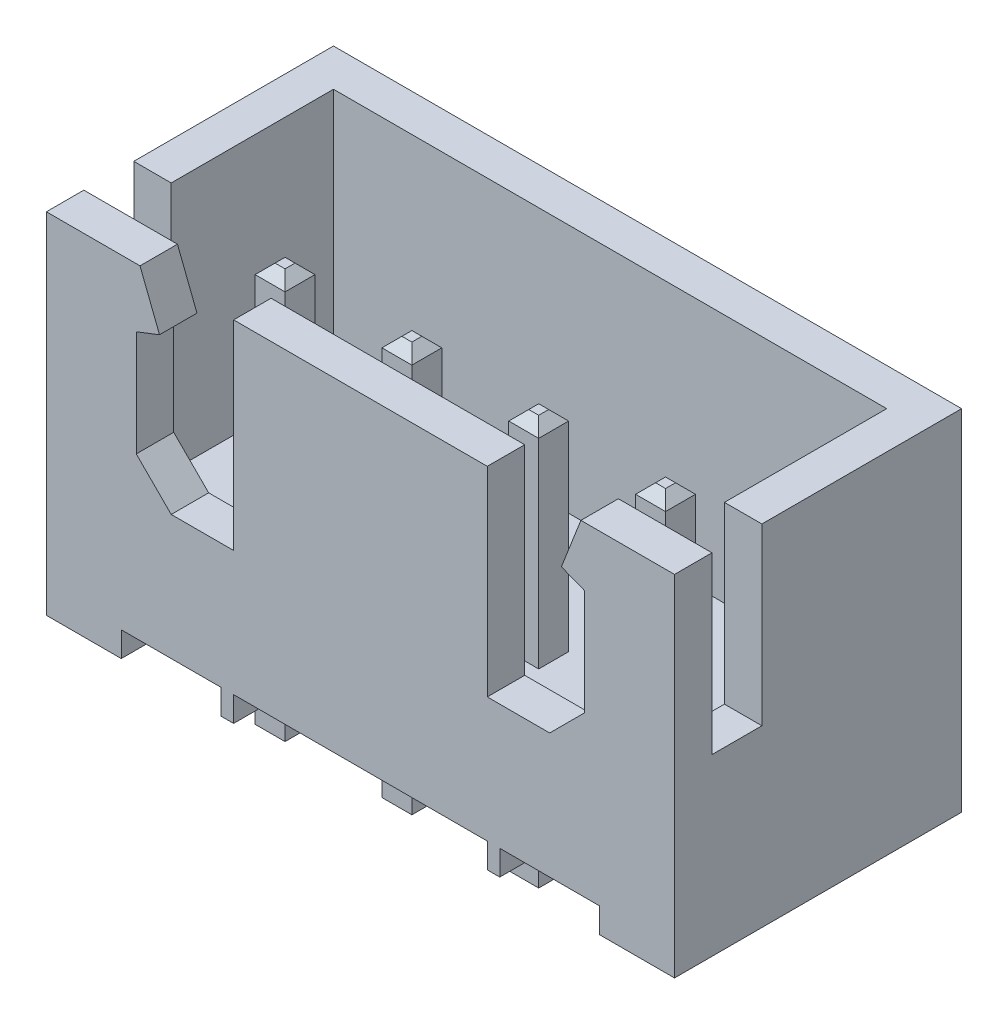
from build123d import *

# Parameters (mm, degrees)
SKETCH1_W           = 3.75
SKETCH1_H           = 5.75
BOSS_EXTRUDE1_DEPTH = 7
CUT_EXTRUDE1_DEPTH  = 5
SKETCH4_W           = 2
SKETCH4_H           = 0.5
CUT_EXTRUDE2_DEPTH  = 10.804335776
CUT_EXTRUDE3_REACH  = 11.804
BOSS_EXTRUDE2_START = -4
SKETCH6_W           = 0.6
SKETCH6_H           = 0.6
BOSS_EXTRUDE2_DEPTH = 8.2
CHAMFER1_SIZE       = 0.2
LPATTERN3_COUNT     = 4
LPATTERN3_PITCH     = 2.54
CHAMFER2_SIZE       = 0.2
CHAMFER3_SIZE       = 0.2
CHAMFER4_SIZE       = 0.2
BOSS_EXTRUDE4_DEPTH = 5.08
SKETCH7_W           = 1
SKETCH7_H           = 3.5
CUT_EXTRUDE4_DEPTH  = 16.502222421


with BuildPart() as part:
    # Sketch1 → Boss-Extrude1 (new body)
    with BuildSketch(Plane(origin=(0, 0, 0), x_dir=(1, 0, 0), z_dir=(0, 1, 0))):
        with Locations((1.875, 2.875)):
            Rectangle(SKETCH1_W, SKETCH1_H)
    extrude(amount=BOSS_EXTRUDE1_DEPTH)

    # Sketch2 → Cut-Extrude1 (cut)
    with BuildSketch(Plane(origin=(0, 7, 0), x_dir=(1, 0, 0), z_dir=(0, 1, 0))):
        Polygon((3, 5), (3.75, 5), (3.75, 0.75), (3, 0.75), (0.75, 0.75), (0.75, 5), align=None)
    extrude(amount=-CUT_EXTRUDE1_DEPTH, mode=Mode.SUBTRACT)

    # Sketch4 → Cut-Extrude2 (cut, through all)
    with BuildSketch(Plane.XY):
        with Locations((2.5, 0.25)):
            Rectangle(SKETCH4_W, SKETCH4_H)
    extrude(amount=-CUT_EXTRUDE2_DEPTH, mode=Mode.SUBTRACT)

    # Sketch5 → Cut-Extrude3 (cut, up to next)
    with BuildSketch(Plane.XY, mode=Mode.PRIVATE) as cut_extrude3_sk1:
        Polygon((1.8, 3.7), (2.5, 3), (3.75, 3), (3.75, 7), (1.875, 7), (2.265714541, 6), (1.8, 5.818038557), align=None)
    cut_extrude3_tool1 = extrude(cut_extrude3_sk1.sketch, amount=-CUT_EXTRUDE3_REACH, mode=Mode.PRIVATE) & part.part
    add(cut_extrude3_tool1.solids().sort_by_distance((2.835359, 5.002769, 0))[0], mode=Mode.SUBTRACT)


with BuildPart() as body_2:
    # Sketch6 → Boss-Extrude2 (new body)
    with BuildSketch(Plane(origin=(0, 2, 0), x_dir=(1, 0, 0), z_dir=(0, 1, 0)).offset(BOSS_EXTRUDE2_START)):
        with Locations((2.48, 2.3)):
            Rectangle(SKETCH6_W, SKETCH6_H)
    boss_extrude2 = extrude(amount=BOSS_EXTRUDE2_DEPTH)

    # Chamfer1
    chamfer1_edges = [body_2.edges().sort_by_distance(p)[0] for p in [
        (2.48, -2, -2.6),
        (2.78, -2, -2.3),
        (2.48, -2, -2),
        (2.48, 6.2, -2.6),
        (2.18, 6.2, -2.3),
        (2.48, 6.2, -2),
        (2.78, 6.2, -2.3),
        (2.18, -2, -2.3),
    ]]
    chamfer(chamfer1_edges, length=CHAMFER1_SIZE)


with BuildPart() as lpattern3_1:
    # LPattern3: pattern copy
    add(boss_extrude2.moved(Location(Vector(1, 0, 0) * (1 * LPATTERN3_PITCH))))

    # Chamfer2
    chamfer2_edges = [lpattern3_1.edges().sort_by_distance(p)[0] for p in [
        (5.02, -2, -2.6),
        (5.32, -2, -2.3),
        (5.02, -2, -2),
        (5.02, 6.2, -2.6),
        (4.72, 6.2, -2.3),
        (5.02, 6.2, -2),
        (5.32, 6.2, -2.3),
        (4.72, -2, -2.3),
    ]]
    chamfer(chamfer2_edges, length=CHAMFER2_SIZE)


with BuildPart() as lpattern3_2:
    # LPattern3: pattern copy
    add(boss_extrude2.moved(Location(Vector(1, 0, 0) * (2 * LPATTERN3_PITCH))))

    # Chamfer3
    chamfer3_edges = [lpattern3_2.edges().sort_by_distance(p)[0] for p in [
        (7.56, -2, -2.6),
        (7.86, -2, -2.3),
        (7.56, -2, -2),
        (7.56, 6.2, -2.6),
        (7.26, 6.2, -2.3),
        (7.56, 6.2, -2),
        (7.86, 6.2, -2.3),
        (7.26, -2, -2.3),
    ]]
    chamfer(chamfer3_edges, length=CHAMFER3_SIZE)


with BuildPart() as lpattern3_3:
    # LPattern3: pattern copy
    add(boss_extrude2.moved(Location(Vector(1, 0, 0) * (3 * LPATTERN3_PITCH))))

    # Chamfer4
    chamfer4_edges = [lpattern3_3.edges().sort_by_distance(p)[0] for p in [
        (10.1, -2, -2.6),
        (10.4, -2, -2.3),
        (10.1, -2, -2),
        (10.1, 6.2, -2.6),
        (9.8, 6.2, -2.3),
        (10.1, 6.2, -2),
        (10.4, 6.2, -2.3),
        (9.8, -2, -2.3),
    ]]
    chamfer(chamfer4_edges, length=CHAMFER4_SIZE)


with BuildPart() as body_6:
    # Mirror4: mirrored copy
    add(part.part.mirror(Plane(origin=(6.29, 0, 0), x_dir=(0, 0, 1), z_dir=(1, 0, 0))))


with BuildPart() as part_1:
    add(part.part)

    add(body_6.part)  # Boss-Extrude4 merges body 6
    # Sketch8<2> → Boss-Extrude4 (add)
    with BuildSketch(Plane(origin=(3.75, 0, 0), x_dir=(0, 0, -1), z_dir=(1, 0, 0))):
        Polygon((0, 0.5), (5.75, 0.5), (5.75, 7), (5, 7), (5, 2), (0.75, 2), (0.75, 7), (0, 7), align=None)
    extrude(amount=BOSS_EXTRUDE4_DEPTH)

    # Sketch7 → Cut-Extrude4 (cut, through all)
    with BuildSketch(Plane(origin=(0, 0, 0), x_dir=(0, 0, -1), z_dir=(1, 0, 0))):
        with Locations((1.25, 5.25)):
            Rectangle(SKETCH7_W, SKETCH7_H)
    extrude(amount=CUT_EXTRUDE4_DEPTH, mode=Mode.SUBTRACT)


solid = Compound([body_2.part, lpattern3_1.part, lpattern3_2.part, lpattern3_3.part, part_1.part])
